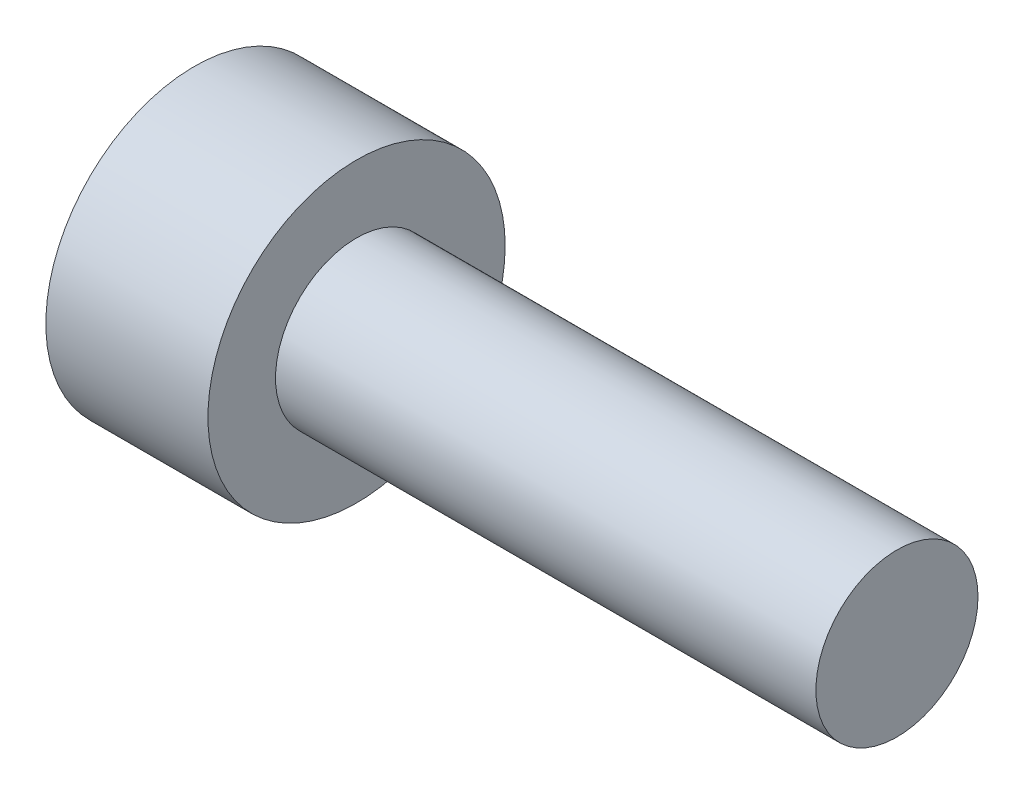
from build123d import *

# Parameters (mm, degrees)
SKIZZE1_R                       = 2.75
AUFSATZ_LINEAR_AUSTRAGEN1_DEPTH = 3
AUFSATZ_LINEAR_START            = 3
SKIZZE2_R                       = 1.5
AUFSATZ_LINEAR_AUSTRAGEN2_DEPTH = 10


with BuildPart() as part:
    # Skizze1 → Aufsatz-Linear austragen1 (new body)
    with BuildSketch(Plane.YZ):
        with Locations(Location((0, 0, 0), (0, 0, 270))):
            Circle(SKIZZE1_R)
    extrude(amount=AUFSATZ_LINEAR_AUSTRAGEN1_DEPTH)

    # Skizze2 → Aufsatz-Linear austragen2 (add)
    with BuildSketch(Plane.YZ.offset(AUFSATZ_LINEAR_START)):
        with Locations(Location((0, 0, 0), (0, 0, 270))):
            Circle(SKIZZE2_R)
    extrude(amount=AUFSATZ_LINEAR_AUSTRAGEN2_DEPTH)


solid = part.part
